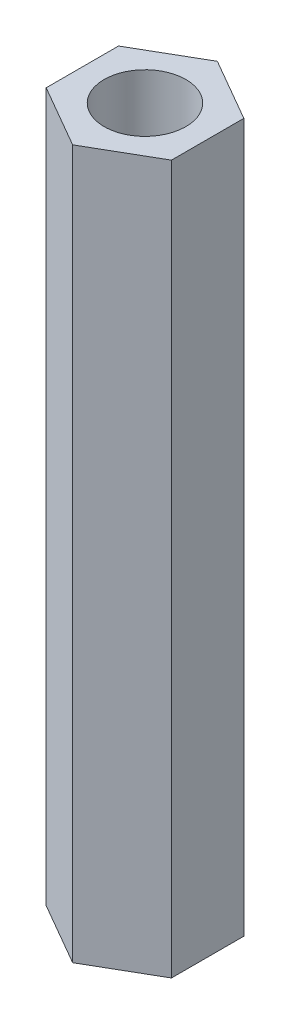
from build123d import *

# Parameters (mm, degrees)
SKETCH_1_R      = 1.5
EXTRUDE_1_DEPTH = 26


with BuildPart() as part:
    # 草图1 → 凸台-拉伸1 (new body)
    with BuildSketch(Plane(origin=(0, 0, 0), x_dir=(1, 0, 0), z_dir=(0, 1, 0))):
        Polygon((0, 2.655811238), (-2.3, 1.327905619), (-2.3, -1.327905619), (0, -2.655811238), (2.3, -1.327905619), (2.3, 1.327905619), align=None)
        with Locations(Location((0, 0, 0), (0, 0, 90))):
            Circle(SKETCH_1_R, mode=Mode.SUBTRACT)
    extrude(amount=EXTRUDE_1_DEPTH)


solid = part.part
